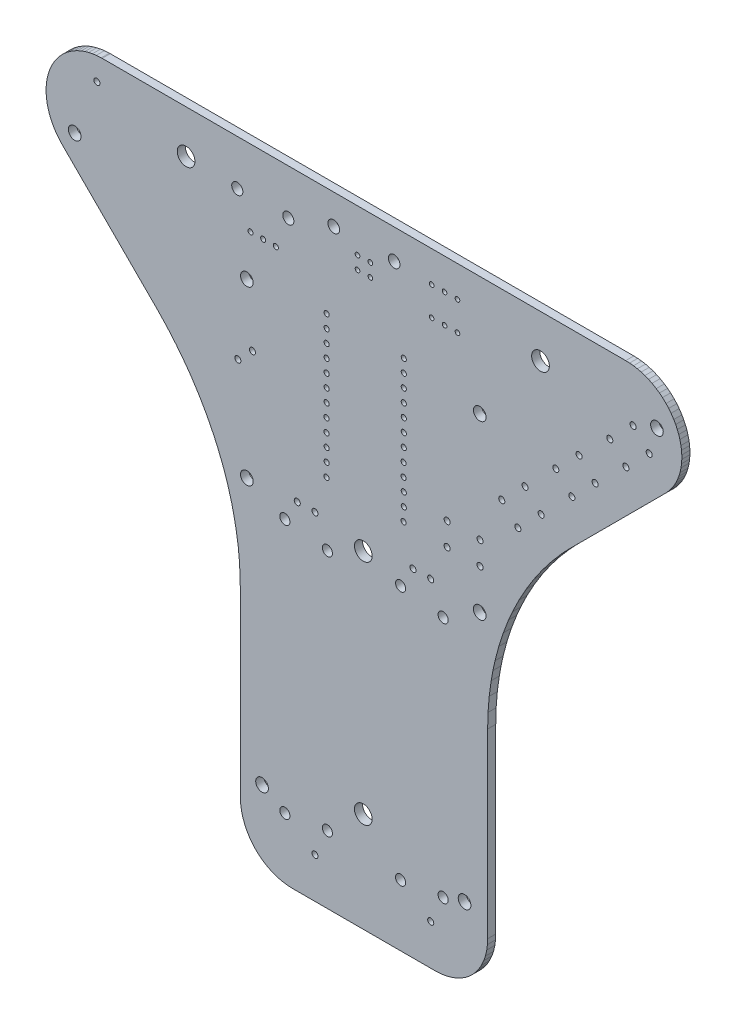
from build123d import *

# Parameters (mm, degrees)
BOSS_EXTRUDE1_DEPTH = 1.6
SKETCH3_R           = 0.599948
SKETCH3_R_2         = 0.4572
SKETCH3_R_3         = 0.459994
SKETCH3_R_4         = 1.1500104
SKETCH3_R_5         = 0.599969507
SKETCH3_R_6         = 1.000001226
SKETCH3_R_7         = 0.999998
SKETCH3_R_8         = 1.000010903
SKETCH3_R_9         = 0.597408
SKETCH3_R_10        = 0.499999
SKETCH3_R_11        = 0.508
SKETCH3_R_12        = 1.2500102
SKETCH3_R_13        = 1.7500092
SKETCH3_R_14        = 1.0999978
CUT_EXTRUDE1_DEPTH  = 102.558921724


with BuildPart() as part:
    # Sketch2 → Boss-Extrude1 (new body)
    with BuildSketch(Plane.XY):
        Polygon((-24.3003324, -33.1691996), (-24.3003324, -69.0428642), (-24.2986052, -69.2460134), (-24.238077, -70.254876), (-24.0519458, -71.4423006), (-23.8036354, -72.4036652), (-23.4726226, -73.3316288), (-23.0613712, -74.2191302), (-22.5730054, -75.0594638), (-22.0112844, -75.846178), (-21.2463634, -76.711175), (-20.5389226, -77.359637), (-19.7735698, -77.9370552), (-18.786856, -78.5300436), (-17.9150518, -78.9365198), (-16.8193212, -79.3144718), (-15.8730442, -79.5350962), (-14.9042882, -79.6681414), (-13.9203684, -79.7125914), (14.1810994, -79.7125914), (14.3787368, -79.7108134), (15.5547314, -79.6254948), (16.5153594, -79.4572706), (17.4506128, -79.2020514), (18.3533796, -78.8617676), (19.3841624, -78.3448776), (20.1917046, -77.8274796), (20.9459576, -77.2354818), (21.6411302, -76.57338), (22.27199, -75.846178), (22.8337364, -75.0594638), (23.3220768, -74.2191302), (23.8060484, -73.1490536), (24.1207036, -72.213851), (24.3883688, -71.0500484), (24.5178072, -70.0542414), (24.561038, -69.0428642), (24.561038, -33.1691996), (24.6388128, -30.291786), (24.8718578, -27.4167854), (25.2595634, -24.5521734), (25.603454, -22.6521264), (26.0151626, -20.7626204), (26.758773, -17.9531518), (27.6518116, -15.1804116), (28.6917384, -12.4521214), (29.4652446, -10.6616754), (30.7434234, -8.024241), (32.1599306, -5.4511194), (33.7108038, -2.9494988), (35.391725, -0.5263388), (37.198046, 1.8116296), (39.1247376, 4.0578786), (40.4734268, 5.5013352), (59.6982296, 24.7379998), (59.8330782, 24.8752106), (60.3477838, 25.4467868), (60.9327204, 26.2089646), (61.35116, 26.8532864), (61.7233462, 27.524964), (62.047501, 28.2207462), (62.322075, 28.9372294), (62.5456712, 29.6709592), (62.7518938, 30.6069238), (62.8572784, 31.3663076), (62.9091198, 32.131127), (62.907164, 32.8976736), (62.8514364, 33.662239), (62.7421656, 34.4210894), (62.5311678, 35.3559872), (62.3038124, 36.0885994), (62.0256062, 36.8036856), (61.6978954, 37.4978422), (61.3222802, 38.1676402), (60.788169, 38.9657336), (60.3117412, 39.5690852), (59.79414, 40.1380452), (59.0930492, 40.7966926), (58.492263, 41.2784544), (57.8591172, 41.7174934), (57.0268862, 42.2030652), (56.3324248, 42.5385992), (55.616094, 42.8253144), (54.8813736, 43.0618138), (54.131845, 43.2469544), (53.3711404, 43.3798726), (52.6029682, 43.4598572), (51.8310368, 43.486578), (-51.5703058, 43.486578), (-51.7634474, 43.4849016), (-52.7270472, 43.426507), (-53.4919428, 43.3200048), (-54.2475166, 43.1608738), (-54.9900856, 42.9499014), (-55.716043, 42.6881544), (-56.4218836, 42.3768266), (-57.104153, 42.0174928), (-57.9188326, 41.5034476), (-58.5361796, 41.0427678), (-59.1196938, 40.5405336), (-59.6665558, 39.9991834), (-60.1740986, 39.4213588), (-60.6398584, 38.8098538), (-61.0615746, 38.1676402), (-61.4371898, 37.4978422), (-61.8391448, 36.6267492), (-62.1047526, 35.9069386), (-62.3646962, 34.9842582), (-62.5137434, 34.2321134), (-62.6096792, 33.471485), (-62.6519956, 32.7060814), (-62.6404894, 31.939611), (-62.5752114, 31.1758076), (-62.4565172, 30.4183542), (-62.2338862, 29.486098), (-61.9974376, 28.756356), (-61.7103414, 28.0447242), (-61.37402, 27.354657), (-60.8868734, 26.527506), (-60.4460818, 25.8980432), (-59.962161, 25.300559), (-59.437524, 24.7379998), (-40.9057094, 6.2061852), (-40.894, 6.1976), (-38.862, 4.064), (-36.9316, 1.8034), (-35.1282, -0.5334), (-33.9852, -2.1336), (-32.4104, -4.5974), (-30.9372, -7.1628), (-29.6164, -9.779), (-28.8036, -11.557), (-27.7114, -14.2748), (-26.7716, -17.018), (-25.9842, -19.812), (-25.5524, -21.717), (-25.1714, -23.5966), (-24.7142, -26.4668), (-24.4348, -29.3327836), align=None)
    extrude(amount=-BOSS_EXTRUDE1_DEPTH)

    # Sketch3 → Cut-Extrude1 (cut, through all)
    with BuildSketch(Plane.XY):
        with Locations((41.2028894, 14.907006)):
            Circle(SKETCH3_R)
        with Locations((38.021006, 18.0888894)):
            Circle(SKETCH3_R)
        with Locations((45.798994, 19.5031106)):
            Circle(SKETCH3_R)
        with Locations((42.6171106, 22.684994)):
            Circle(SKETCH3_R)
        with Locations((51.8708894, 25.321006)):
            Circle(SKETCH3_R)
        with Locations((48.689006, 28.5028894)):
            Circle(SKETCH3_R)
        with Locations((56.466994, 29.9171106)):
            Circle(SKETCH3_R)
        with Locations((53.2851106, 33.098994)):
            Circle(SKETCH3_R)
        with Locations((35.130994, 8.8351106)):
            Circle(SKETCH3_R)
        with Locations((31.9491106, 12.016994)):
            Circle(SKETCH3_R)
        with Locations((27.353006, 7.4208894)):
            Circle(SKETCH3_R)
        with Locations((30.5348894, 4.239006)):
            Circle(SKETCH3_R)
        with Locations((23.06193, -6.059932)):
            Circle(SKETCH3_R)
        with Locations((23.06193, -1.560068)):
            Circle(SKETCH3_R)
        with Locations((16.56207, -1.560068)):
            Circle(SKETCH3_R)
        with Locations((16.56207, -6.059932)):
            Circle(SKETCH3_R)
        with Locations((13.5019796, 31.6440312)):
            Circle(SKETCH3_R_2)
        with Locations((16.0521396, 31.6440312)):
            Circle(SKETCH3_R_2)
        with Locations((18.6022996, 31.6440312)):
            Circle(SKETCH3_R_2)
        with Locations((18.6019694, 37.3440198)):
            Circle(SKETCH3_R_2)
        with Locations((16.0518094, 37.3440198)):
            Circle(SKETCH3_R_2)
        with Locations((13.5018018, 37.3438674)):
            Circle(SKETCH3_R_2)
        with Locations((-1.143, 32.512)):
            Circle(SKETCH3_R_3)
        with Locations((-1.143, 35.052)):
            Circle(SKETCH3_R_3)
        with Locations((1.397, 35.052)):
            Circle(SKETCH3_R_3)
        with Locations((1.397, 32.512)):
            Circle(SKETCH3_R_3)
        with Locations((6.096, 37.592)):
            Circle(SKETCH3_R_4)
        with Locations((-5.842, 37.592)):
            Circle(SKETCH3_R_4)
        with Locations((-52.6154142, 38.979094)):
            Circle(SKETCH3_R)
        with Locations((-24.7766078, 5.392928)):
            Circle(SKETCH3_R)
        with Locations((-21.902928, 8.2666078)):
            Circle(SKETCH3_R)
        with Locations((-13.04417, -13.124434)):
            Circle(SKETCH3_R_5)
        with Locations((-9.54405, -13.119354)):
            Circle(SKETCH3_R)
        with Locations((-15.494, -17.272)):
            Circle(SKETCH3_R_6)
        with Locations((-7.09422, -18.469356)):
            Circle(SKETCH3_R_7)
        with Locations((-15.494, -67.56654)):
            Circle(SKETCH3_R_8)
        with Locations((-7.09422, -66.366644)):
            Circle(SKETCH3_R_8)
        with Locations((-9.54405, -71.711566)):
            Circle(SKETCH3_R)
        with Locations((7.366, -67.56654)):
            Circle(SKETCH3_R_8)
        with Locations((15.76578, -66.364104)):
            Circle(SKETCH3_R_6)
        with Locations((13.31595, -71.711566)):
            Circle(SKETCH3_R)
        with Locations((7.366, -17.27454)):
            Circle(SKETCH3_R_8)
        with Locations((9.81583, -13.119354)):
            Circle(SKETCH3_R)
        with Locations((13.31595, -13.121894)):
            Circle(SKETCH3_R_9)
        with Locations((15.76578, -18.469356)):
            Circle(SKETCH3_R_7)
        with Locations((-22.27072, 28.4481016)):
            Circle(SKETCH3_R_10)
        with Locations((-17.272, 28.4481016)):
            Circle(SKETCH3_R_10)
        with Locations((-19.77136, 28.4481016)):
            Circle(SKETCH3_R_10)
        with Locations((-7.23646, 21.971)):
            Circle(SKETCH3_R_11)
        with Locations((-7.23646, 19.431)):
            Circle(SKETCH3_R_11)
        with Locations((-7.23646, 16.891)):
            Circle(SKETCH3_R_11)
        with Locations((-7.23646, 9.271)):
            Circle(SKETCH3_R_11)
        with Locations((-7.23646, 14.351)):
            Circle(SKETCH3_R_11)
        with Locations((-7.23646, 11.811)):
            Circle(SKETCH3_R_11)
        with Locations((-7.2720165, 4.150233)):
            Circle(SKETCH3_R_11)
        with Locations((-7.23646, 6.731)):
            Circle(SKETCH3_R_11)
        with Locations((-7.2720165, 1.610233)):
            Circle(SKETCH3_R_11)
        with Locations((19.99996, -65.000124)):
            Circle(SKETCH3_R_12)
        with Locations((0, -60.000134)):
            Circle(SKETCH3_R_13)
        with Locations((-19.99996, -65.000124)):
            Circle(SKETCH3_R_12)
        with Locations((-22.999954, -13.999972)):
            Circle(SKETCH3_R_12)
        with Locations((22.999954, -13.999972)):
            Circle(SKETCH3_R_12)
        with Locations((0, -14.99997)):
            Circle(SKETCH3_R_13)
        with Locations((22.999954, 19.99996)):
            Circle(SKETCH3_R_12)
        with Locations((58.000138, 34.99993)):
            Circle(SKETCH3_R_12)
        with Locations((34.99993, 34.99993)):
            Circle(SKETCH3_R_13)
        with Locations((-22.999954, 19.99996)):
            Circle(SKETCH3_R_12)
        with Locations((-14.81201, 34.544)):
            Circle(SKETCH3_R_14)
        with Locations((-56.999886, 27.999944)):
            Circle(SKETCH3_R_12)
        with Locations((-24.892, 34.544)):
            Circle(SKETCH3_R_14)
        with Locations((-34.99993, 34.99993)):
            Circle(SKETCH3_R_13)
        with Locations((-7.23646, -3.429)):
            Circle(SKETCH3_R_11)
        with Locations((-7.23646, -0.889)):
            Circle(SKETCH3_R_11)
        with Locations((-7.2720165, -6.009767)):
            Circle(SKETCH3_R_11)
        with Locations((7.99846, 21.971)):
            Circle(SKETCH3_R_11)
        with Locations((7.99846, 19.431)):
            Circle(SKETCH3_R_11)
        with Locations((7.99846, 16.891)):
            Circle(SKETCH3_R_11)
        with Locations((7.99846, 9.271)):
            Circle(SKETCH3_R_11)
        with Locations((7.99846, 14.351)):
            Circle(SKETCH3_R_11)
        with Locations((7.99846, 11.811)):
            Circle(SKETCH3_R_11)
        with Locations((7.9629035, 4.150233)):
            Circle(SKETCH3_R_11)
        with Locations((7.99846, 6.731)):
            Circle(SKETCH3_R_11)
        with Locations((7.9629035, 1.610233)):
            Circle(SKETCH3_R_11)
        with Locations((7.99846, -3.429)):
            Circle(SKETCH3_R_11)
        with Locations((7.99846, -0.889)):
            Circle(SKETCH3_R_11)
        with Locations((7.9629035, -6.009767)):
            Circle(SKETCH3_R_11)
    extrude(amount=-CUT_EXTRUDE1_DEPTH, mode=Mode.SUBTRACT)


solid = part.part
